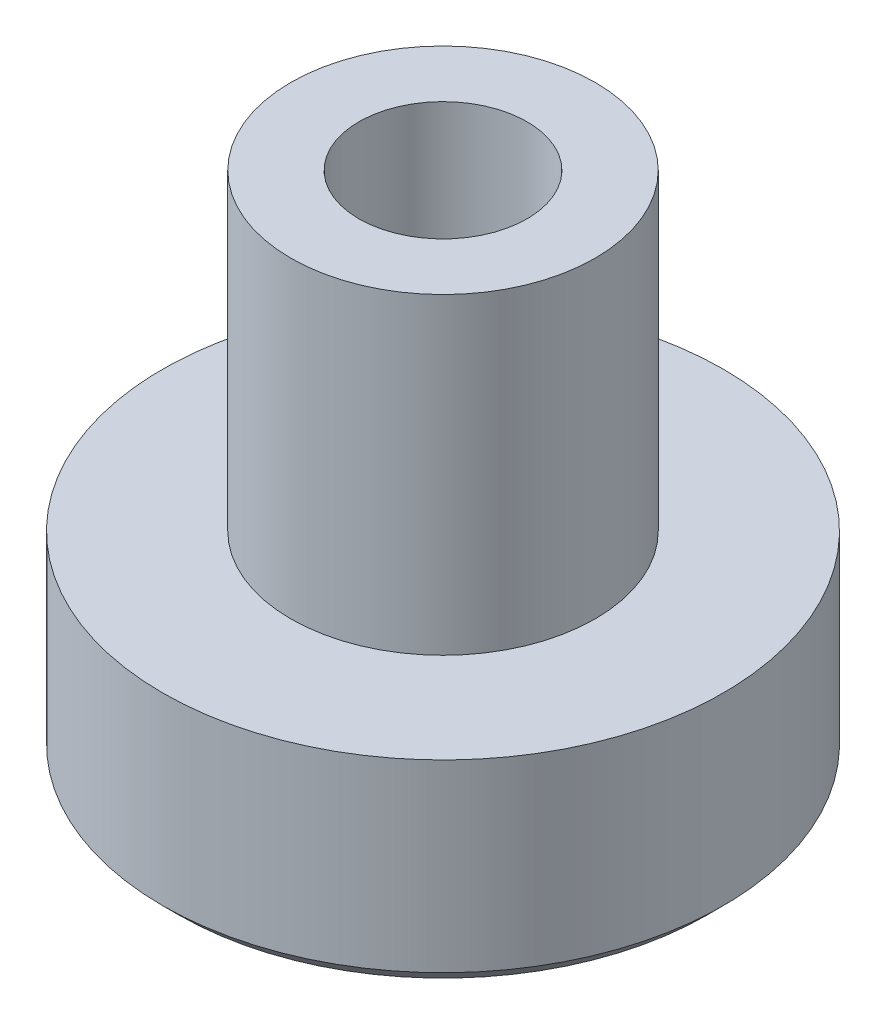
from build123d import *

# Parameters (mm, degrees)
SKETCH1_R           = 7
SKETCH1_R_2         = 2.1
BOSS_EXTRUDE1_DEPTH = 5
SKETCH2_R           = 3.8
SKETCH2_R_2         = 2.1
BOSS_EXTRUDE2_DEPTH = 7.8
CHAMFER1_SIZE       = 0.4
CHAMFER1_SIZE2      = 0.399999869


with BuildPart() as part:
    # Sketch1 → Boss-Extrude1 (new body)
    with BuildSketch(Plane(origin=(0, 0, 0), x_dir=(1, 0, 0), z_dir=(0, 1, 0))):
        with Locations(Location((0, 0, 0), (0, 0, 270))):
            Circle(SKETCH1_R)
        with Locations(Location((0, 0, 0), (0, 0, 270))):
            Circle(SKETCH1_R_2, mode=Mode.SUBTRACT)
    extrude(amount=BOSS_EXTRUDE1_DEPTH)

    # Sketch2 → Boss-Extrude2 (add)
    with BuildSketch(Plane(origin=(0, 5, 0), x_dir=(1, 0, 0), z_dir=(0, 1, 0))):
        with Locations(Location((0, 0, 0), (0, 0, 270))):
            Circle(SKETCH2_R)
        with Locations(Location((0, 0, 0), (0, 0, 270))):
            Circle(SKETCH2_R_2, mode=Mode.SUBTRACT)
    extrude(amount=BOSS_EXTRUDE2_DEPTH)

    # Chamfer1
    chamfer1_edges = [part.edges().sort_by_distance(p)[0] for p in [
        (0, 0, -7),
    ]]
    chamfer1_side = [part.faces().sort_by_distance(p)[0] for p in [
        (0, 2.5, -7),
    ]]
    chamfer(chamfer1_edges, length=CHAMFER1_SIZE, length2=CHAMFER1_SIZE2, reference=chamfer1_side[0])


solid = part.part
